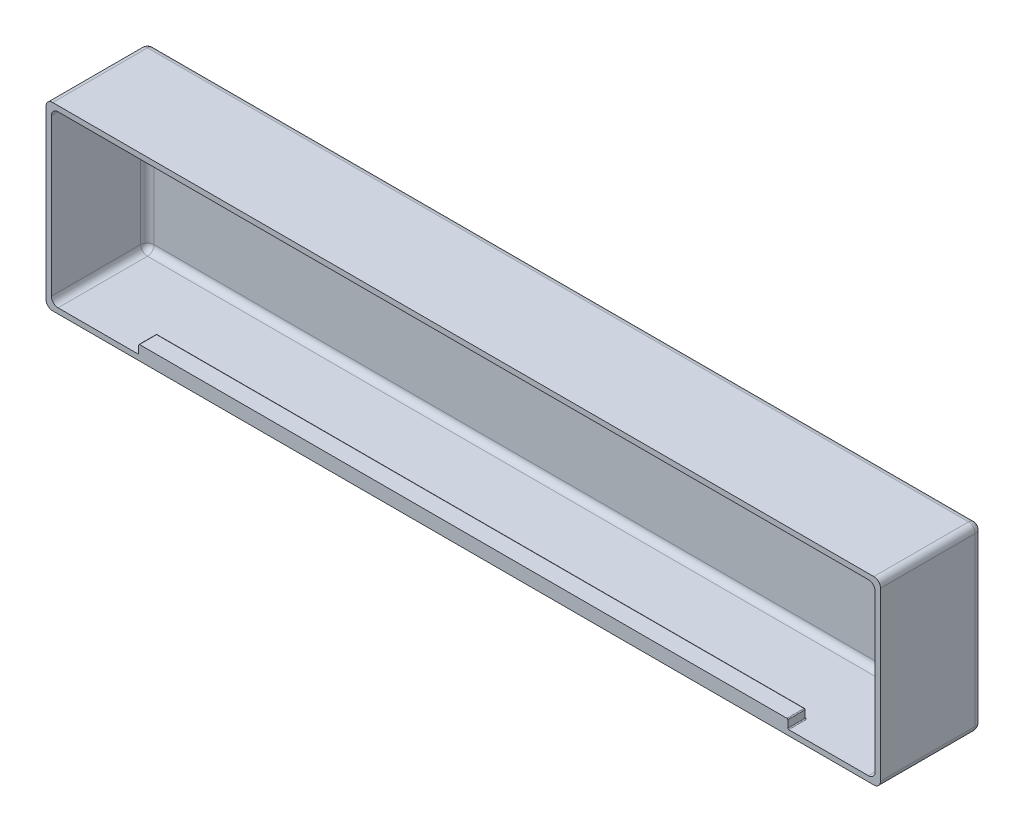
from build123d import *

# Parameters (mm, degrees)
SKETCH1_W           = 237.236
SKETCH1_H           = 51.308
BOSS_EXTRUDE1_DEPTH = 28.829
SHELL1_T            = -1.524
FILLET1_R           = 1.905
FILLET2_R           = 1.905
SKETCH2_R           = 4.826
CUT_EXTRUDE1_DEPTH  = 2.54
SKETCH3_W           = 184.531
SKETCH3_H           = 5.08
BOSS_EXTRUDE2_DEPTH = 2.54
FILLET3_R           = 0.254


with BuildPart() as part:
    # Sketch1 → Boss-Extrude1 (new body)
    with BuildSketch(Plane.XY):
        Rectangle(SKETCH1_W, SKETCH1_H)
    extrude(amount=BOSS_EXTRUDE1_DEPTH)

    # Shell1
    shell1_openings = [part.faces().sort_by_distance(p)[0] for p in [
        (0, 0, 28.829),
    ]]
    offset(amount=SHELL1_T, openings=shell1_openings, kind=Kind.INTERSECTION)

    # Fillet1
    fillet1_edges = [part.edges().sort_by_distance(p)[0] for p in [
        (117.094, 0, 1.524),
        (117.094, -24.13, 15.1765),
        (0, 24.13, 1.524),
        (117.094, 24.13, 15.1765),
        (-117.094, 0, 1.524),
        (-117.094, 24.13, 15.1765),
        (0, -24.13, 1.524),
        (-117.094, -24.13, 15.1765),
    ]]
    fillet(fillet1_edges, radius=FILLET1_R)

    # Fillet2
    fillet2_edges = [part.edges().sort_by_distance(p)[0] for p in [
        (0, -25.654, 0),
        (-118.618, 0, 0),
        (0, 25.654, 0),
        (118.618, 0, 0),
        (118.618, -25.654, 14.4145),
        (-118.618, -25.654, 14.4145),
        (-118.618, 25.654, 14.4145),
        (118.618, 25.654, 14.4145),
    ]]
    fillet(fillet2_edges, radius=FILLET2_R)

    # Sketch2 → Cut-Extrude1 (cut)
    with BuildSketch(Plane(origin=(0, 0, 0), x_dir=(-1, 0, 0), z_dir=(0, 0, -1))):
        with Locations((-45.2, 2.46)):
            Circle(SKETCH2_R)
        with Locations((45, 2.46)):
            Circle(SKETCH2_R)
    extrude(amount=-CUT_EXTRUDE1_DEPTH, mode=Mode.SUBTRACT)

    # Sketch3 → Boss-Extrude2 (add)
    with BuildSketch(Plane(origin=(0, -24.13, 0), x_dir=(1, 0, 0), z_dir=(0, 1, 0))):
        with Locations((0, -26.289)):
            Rectangle(SKETCH3_W, SKETCH3_H)
    extrude(amount=BOSS_EXTRUDE2_DEPTH)

    # Fillet3
    fillet3_edges = [part.edges().sort_by_distance(p)[0] for p in [
        (-92.2655, -24.13, 26.289),
        (-92.2655, -22.86, 23.749),
        (92.2655, -24.13, 26.289),
        (0, -24.13, 23.749),
        (92.2655, -22.86, 23.749),
        (-92.2655, -21.59, 26.289),
        (92.2655, -21.59, 26.289),
        (0, -21.59, 23.749),
    ]]
    fillet(fillet3_edges, radius=FILLET3_R)


solid = part.part
